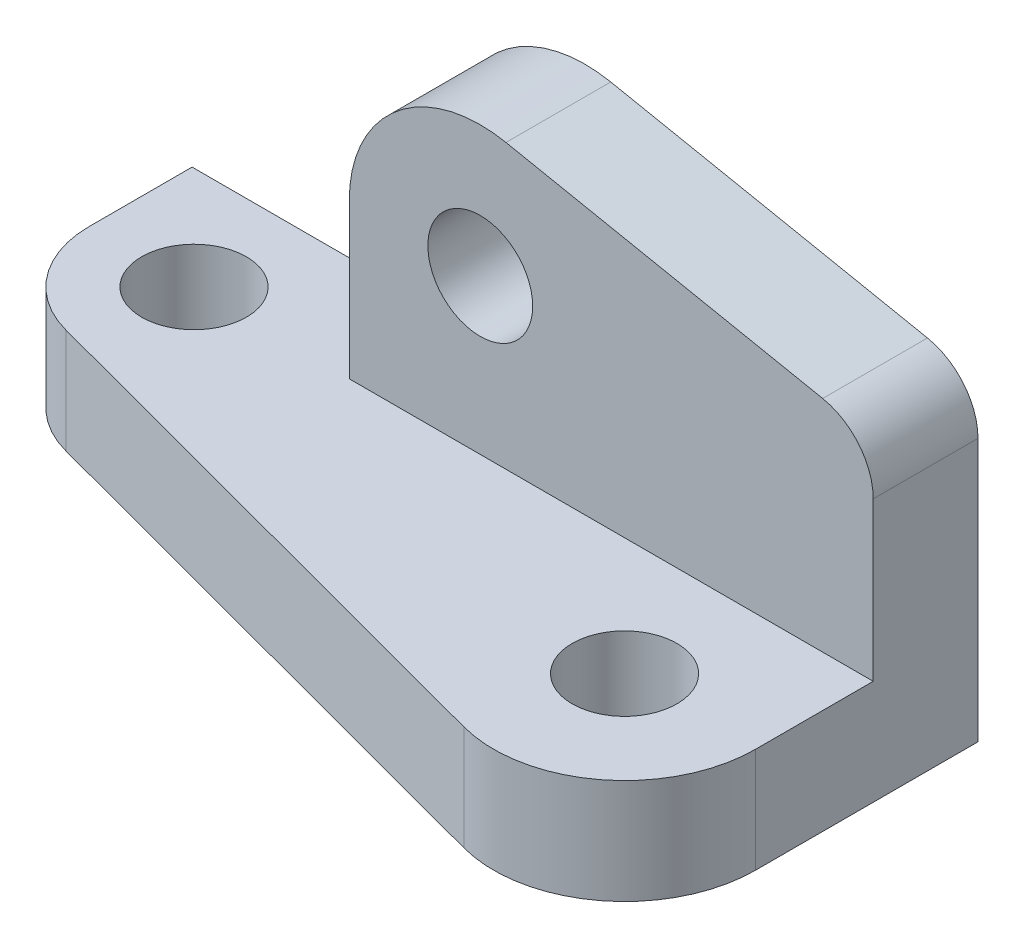
from build123d import *

# Parameters (mm, degrees)
EXTRUDE_1_DEPTH         = 20
EXTRUDE_2_DEPTH         = 20
FILLET_1_R              = 12
FILLET_2_R              = 20
FILLET_3_R              = 25
HOLE_WIZARD_20_0_20_1_D = 20
HOLE_WIZARD_20_0_20_2_D = 20


with BuildPart() as part:
    # 草圖1 → 填料-伸長1 (new body)
    with BuildSketch(Plane(origin=(0, 0, 0), x_dir=(1, 0, 0), z_dir=(0, 1, 0))):
        Polygon((0, 0), (150, 0), (150, -75), (0, -35), align=None)
    extrude(amount=EXTRUDE_1_DEPTH)

    # 草圖2 → 填料-伸長2 (add)
    with BuildSketch(Plane(origin=(0, 0, 0), x_dir=(-1, 0, 0), z_dir=(0, 0, -1))):
        Polygon((-150, 0), (-150, 60), (-50, 80), (-50, 0), align=None)
    extrude(amount=-EXTRUDE_2_DEPTH)

    # 圓角1
    fillet_1_edges = [part.edges().sort_by_distance(p)[0] for p in [
        (150, 60, 10),
    ]]
    fillet(fillet_1_edges, radius=FILLET_1_R)

    # 圓角2
    fillet_2_edges = [part.edges().sort_by_distance(p)[0] for p in [
        (0, 10, 35),
    ]]
    fillet(fillet_2_edges, radius=FILLET_2_R)

    # 圓角3
    fillet_3_edges = [part.edges().sort_by_distance(p)[0] for p in [
        (50, 80, 10),
        (150, 10, 75),
    ]]
    fillet(fillet_3_edges, radius=FILLET_3_R)

    # Ø20.0 (20) 直徑孔1 (through all)
    with Locations(Plane(origin=(0, 20, 0), x_dir=(1, 0, 0), z_dir=(0, 1, 0))):
        with Locations((125, -42.45970884), (20, -19.634433738)):
            Hole(HOLE_WIZARD_20_0_20_1_D / 2)

    # Ø20.0 (20) 直徑孔2 (through all)
    with Locations(Plane.XY.offset(20)):
        with Locations((75, 49.504902432)):
            Hole(HOLE_WIZARD_20_0_20_2_D / 2)


solid = part.part
